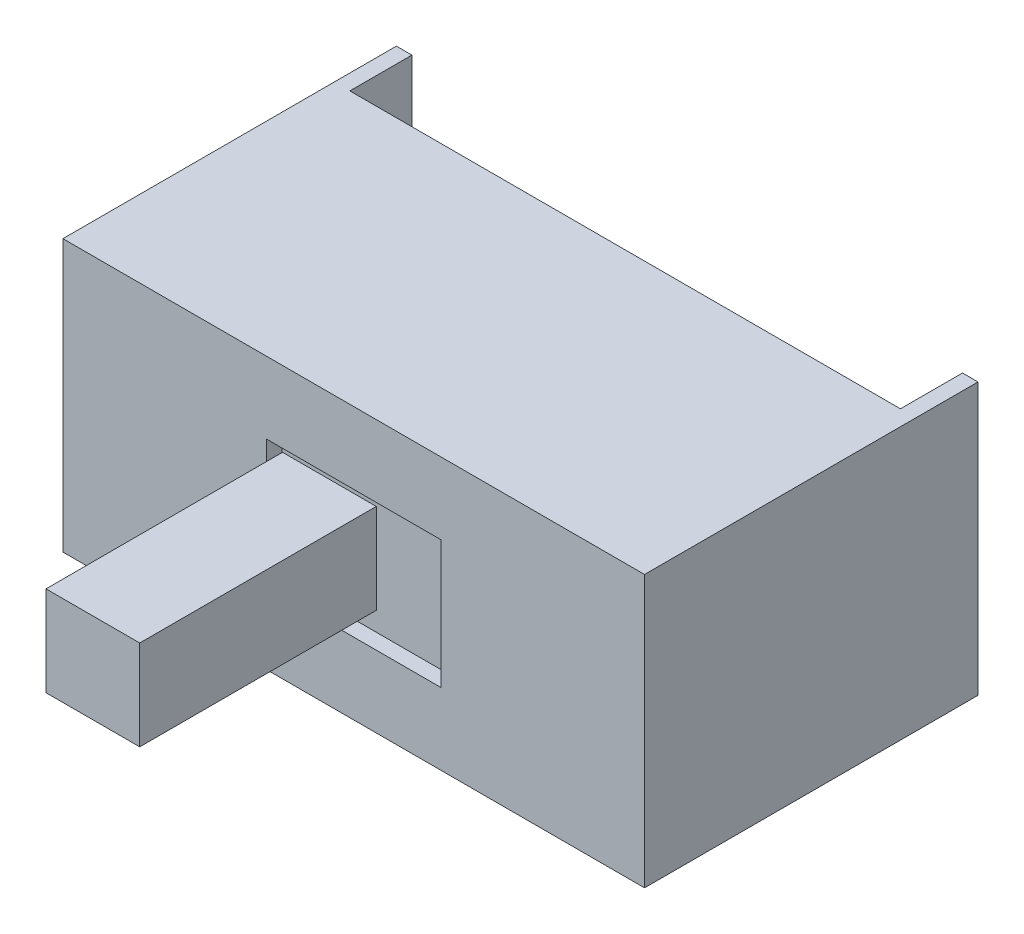
from build123d import *

# Parameters (mm, degrees)
SKETCH_1_W      = 15
SKETCH_1_H      = 7
SKETCH_1_W_2    = 4.5
SKETCH_1_H_2    = 3.3
EXTRUDE_1_DEPTH = 0.4
SKETCH_2_W      = 15
SKETCH_2_H      = 7
EXTRUDE_2_DEPTH = 6.6
SKETCH_3_W      = 8.6
SKETCH_3_H      = 7
EXTRUDE_3_DEPTH = 0.4
SKETCH_4_W      = 8.6
SKETCH_4_H      = 7
EXTRUDE_4_DEPTH = 0.4
SKETCH_5_W      = 2.417347104
SKETCH_5_H      = 2.320372832
EXTRUDE_5_DEPTH = 6.1


with BuildPart() as part:
    # Эскиз1 → Бобышка-Вытянуть1 (new body)
    with BuildSketch(Plane.XY):
        with Locations((7.5, 3.5)):
            Rectangle(SKETCH_1_W, SKETCH_1_H)
        with Locations((7.5, 3.5)):
            Rectangle(SKETCH_1_W_2, SKETCH_1_H_2, mode=Mode.SUBTRACT)
    extrude(amount=EXTRUDE_1_DEPTH)

    # Эскиз2 → Бобышка-Вытянуть2 (add)
    with BuildSketch(Plane(origin=(0, 0, 0), x_dir=(-1, 0, 0), z_dir=(0, 0, -1))):
        with Locations((-7.5, 3.5)):
            Rectangle(SKETCH_2_W, SKETCH_2_H)
    extrude(amount=EXTRUDE_2_DEPTH)

    # Эскиз3 → Бобышка-Вытянуть3 (add)
    with BuildSketch(Plane(origin=(15, 0, 0), x_dir=(0, 0, -1), z_dir=(1, 0, 0))):
        with Locations((3.9, 3.5)):
            Rectangle(SKETCH_3_W, SKETCH_3_H)
    extrude(amount=-EXTRUDE_3_DEPTH)

    # Эскиз4 → Бобышка-Вытянуть4 (add)
    with BuildSketch(Plane.ZY):
        with Locations((-3.9, 3.5)):
            Rectangle(SKETCH_4_W, SKETCH_4_H)
    extrude(amount=-EXTRUDE_4_DEPTH)

    # Эскиз5 → Бобышка-Вытянуть5 (add)
    with BuildSketch(Plane.XY):
        with Locations((6.472493098, 3.5)):
            Rectangle(SKETCH_5_W, SKETCH_5_H)
    extrude(amount=EXTRUDE_5_DEPTH)


solid = part.part
